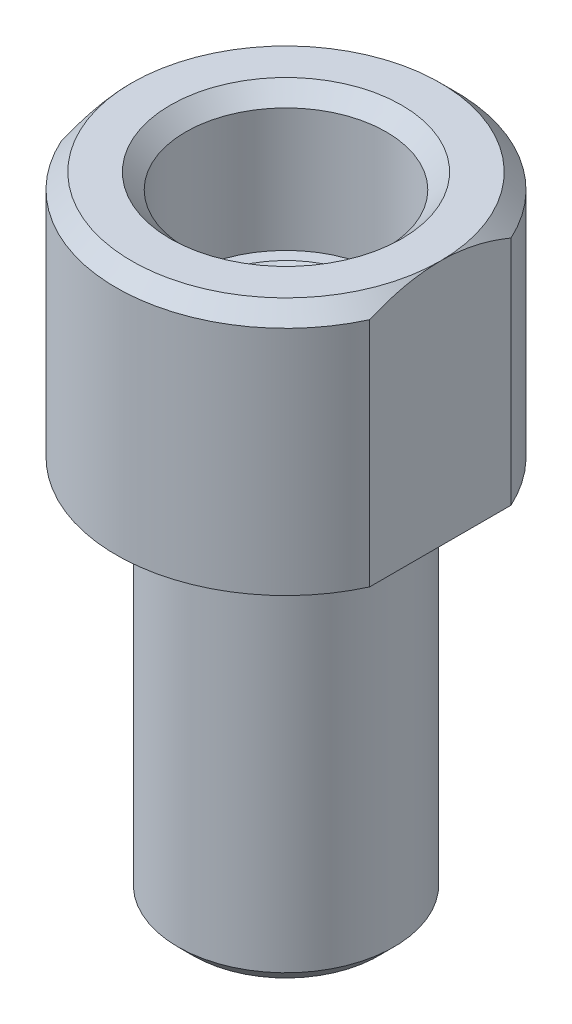
from build123d import *

# Parameters (mm, degrees)
CHANFREIN3_SIZE         = 1
ENL_V_MAT_EXTRU_1_DEPTH = 44.852023899
CHANFREIN1_SIZE         = 1
CHANFREIN2_SIZE         = 0.5


with BuildPart() as part:
    # Esquisse1 → Révolution1 (revolve)
    with BuildSketch(Plane.XY, mode=Mode.PRIVATE) as r_volution1_sk:
        Polygon((4.8, 10), (4, 10), (4, 26), (5.2, 26), (5.2, 32), (6.5, 32), (6.5, 41), (11, 41), (11, 25), (9.55, 25), (9.55, 26.13), (7.55, 26.13), (7.55, 25), (7, 25), (7, 0), (4.8, 0), align=None)
    revolve(r_volution1_sk.sketch.rotate(Axis((0, 0, 0), (0, 1, 0)), 90), axis=Axis((0, 0, 0), (0, 1, 0)))

    # Chanfrein3
    chanfrein3_edges = [part.edges().sort_by_distance(p)[0] for p in [
        (0, 41, 11),
    ]]
    chamfer(chanfrein3_edges, length=CHANFREIN3_SIZE)

    # Esquisse2 → Enlèv. mat.-Extru.1 (cut, through all)
    with BuildSketch(Plane(origin=(0, 41, 0), x_dir=(1, 0, 0), z_dir=(0, 1, 0))):
        with BuildLine():
            Line((-10, 4.582575695), (-10, -4.582575695))
            ThreePointArc((-10, -4.582575695), (-11, 0), (-10, 4.582575695))
        make_face()
        with BuildLine():
            Line((10, 4.582575695), (10, -4.582575695))
            ThreePointArc((10, -4.582575695), (11, 0), (10, 4.582575695))
        make_face()
    extrude(amount=-ENL_V_MAT_EXTRU_1_DEPTH, mode=Mode.SUBTRACT)

    # Chanfrein1
    chanfrein1_edges = [part.edges().sort_by_distance(p)[0] for p in [
        (0, 41, 6.5),
        (0, 0, 7),
    ]]
    chamfer(chanfrein1_edges, length=CHANFREIN1_SIZE)

    # Chanfrein2
    chanfrein2_edges = [part.edges().sort_by_distance(p)[0] for p in [
        (0, 10, 4),
        (0, 26, 4),
        (0, 32, 5.2),
        (0, 0, 4.8),
    ]]
    chamfer(chanfrein2_edges, length=CHANFREIN2_SIZE)


solid = part.part
